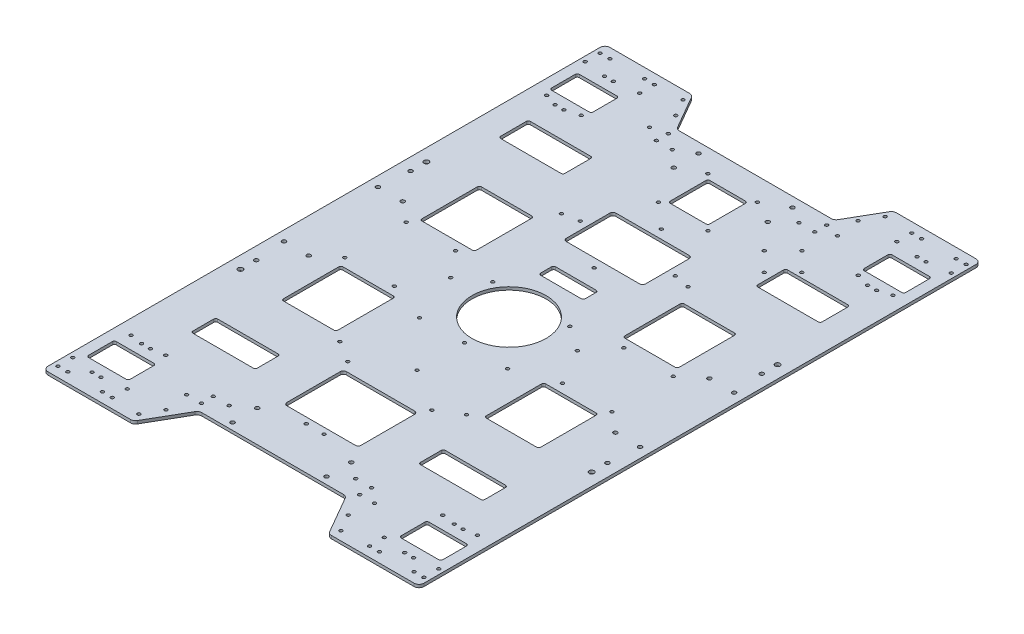
from build123d import *

# Parameters (mm, degrees)
EXTRUDE_1009_DEPTH      = 3
SKETCH_2_R              = 1.6
SKETCH_2_R_2            = 37.5
CUT_EXTRUDE_1674_DEPTH  = 3
SKETCH_8_W              = 65
SKETCH_8_H              = 25
CUT_EXTRUDE_2546_DEPTH  = 3
SKETCH_41_W             = 55
SKETCH_41_H             = 60
CUT_EXTRUDE_2_DEPTH     = 10
SKETCH_10_W             = 65
SKETCH_10_H             = 30
CUT_EXTRUDE_3752_DEPTH  = 3
SKETCH_11_R             = 1.6
SKETCH_11_W             = 42
SKETCH_11_H             = 28
CUT_EXTRUDE_4861_DEPTH  = 3
SKETCH_13_R             = 1.6
CUT_EXTRUDE_5517_DEPTH  = 3
SKETCH_14_R             = 2
CUT_EXTRUDE_5867_DEPTH  = 3
SKETCH_15_R             = 2
CUT_EXTRUDE_6127_DEPTH  = 3
SKETCH_16_R             = 1.6
CUT_EXTRUDE_6634_DEPTH  = 3
SKETCH_19_R             = 2
SKETCH_19_R_2           = 2.5
CUT_EXTRUDE_7800_DEPTH  = 3
SKETCH_21_R             = 1.6
CUT_EXTRUDE_7952_DEPTH  = 3
CUT_EXTRUDE_9_DEPTH     = 10
SKETCH_33_R             = 1.6
PC_DEPTH                = 10
SKETCH_36_R             = 1.6
CUT_EXTRUDE_9295_DEPTH  = 345.206333469
SKETCH_29_R             = 1.6
CUT_EXTRUDE_9677_DEPTH  = 10
SKETCH_39_R             = 1.6
CUT_EXTRUDE_10279_DEPTH = 10
SKETCH_42_W             = 40
SKETCH_42_H             = 40
CUT_EXTRUDE_11_DEPTH    = 10
SKETCH_34_R             = 1.6
UWB_DEPTH               = 10
SKETCH_47_R             = 1.6
CUT_EXTRUDE_13112_DEPTH = 345.206333469
SKETCH_48_R             = 1.6
CUT_EXTRUDE_14_DEPTH    = 345.206333469
CUT_EXTRUDE_6623_DEPTH  = 10
FILLET_13907_R          = 5
FILLET_14506_R          = 2
SKETCH_53_R             = 1.6
RFID_DEPTH              = 10
SKETCH_54_R             = 1.6
CUT_EXTRUDE_19127_DEPTH = 10


with BuildPart() as part:
    # 草图1 → Extrude 1009 (new body)
    with BuildSketch(Plane(origin=(0, 0, 0), x_dir=(1, 0, 0), z_dir=(0, 1, 0))):
        Polygon((190, 287), (101.545, 287), (79.605689771, 249), (-79.605689771, 249), (-101.545, 287), (-190, 287), (-190, 0), (-190, -281), (-144.091695942, -281), (-98.660254038, -281), (-74.411542732, -239), (74.411542732, -239), (98.660254038, -281), (144.091695942, -281), (190, -281), (190, 0), align=None)
    extrude(amount=EXTRUDE_1009_DEPTH)

    # 草图2 → Cut-Extrude 1674 (cut)
    with BuildSketch(Plane(origin=(0, 3, 0), x_dir=(1, 0, 0), z_dir=(0, 1, 0))):
        with Locations(Location((38.97114317, 22.5, 0), (0, 0, 270))):
            Circle(SKETCH_2_R)
        with Locations(Location((0, 0, 0), (0, 0, 270))):
            Circle(SKETCH_2_R_2)
        with Locations(Location((0, -45, 0), (0, 0, 270))):
            Circle(SKETCH_2_R)
        with Locations(Location((-38.97114317, 22.5, 0), (0, 0, 270))):
            Circle(SKETCH_2_R)
    extrude(amount=-CUT_EXTRUDE_1674_DEPTH, mode=Mode.SUBTRACT)

    # 草图8 → Cut-Extrude 2546 (cut)
    with BuildSketch(Plane(origin=(0, 3, 0), x_dir=(1, 0, 0), z_dir=(0, 1, 0))):
        with Locations((115, -161.5)):
            Rectangle(SKETCH_8_W, SKETCH_8_H)
        with Locations((-115, -161.5)):
            Rectangle(SKETCH_8_W, SKETCH_8_H)
    extrude(amount=-CUT_EXTRUDE_2546_DEPTH, mode=Mode.SUBTRACT)

    # 草图41 → 减重过线孔2 (cut)
    with BuildSketch(Plane(origin=(0, 3, 0), x_dir=(1, 0, 0), z_dir=(0, 1, 0))):
        with Locations((-102.5, 70)):
            Rectangle(SKETCH_41_W, SKETCH_41_H)
        with Locations((102.5, 70)):
            Rectangle(SKETCH_41_W, SKETCH_41_H)
        with Locations((102.5, -70)):
            Rectangle(SKETCH_41_W, SKETCH_41_H)
        with Locations((-102.5, -70)):
            Rectangle(SKETCH_41_W, SKETCH_41_H)
    extrude(amount=-CUT_EXTRUDE_2_DEPTH, mode=Mode.SUBTRACT)

    # 草图10 → Cut-Extrude 3752 (cut)
    with BuildSketch(Plane(origin=(0, 3, 0), x_dir=(1, 0, 0), z_dir=(0, 1, 0))):
        with Locations((-130, 167)):
            Rectangle(SKETCH_10_W, SKETCH_10_H)
        with Locations((130, 167)):
            Rectangle(SKETCH_10_W, SKETCH_10_H)
    extrude(amount=-CUT_EXTRUDE_3752_DEPTH, mode=Mode.SUBTRACT)

    # 草图11 → Cut-Extrude 4861 (cut)
    with BuildSketch(Plane(origin=(0, 3, 0), x_dir=(1, 0, 0), z_dir=(0, 1, 0))):
        with Locations(Location((-153.5, 259, 0), (0, 0, 270))):
            Circle(SKETCH_11_R)
        with Locations(Location((-162.5, 259, 0), (0, 0, 90))):
            Circle(SKETCH_11_R)
        with Locations(Location((-153.5, 209, 0), (0, 0, 90))):
            Circle(SKETCH_11_R)
        with Locations(Location((-162.5, 209, 0), (0, 0, 270))):
            Circle(SKETCH_11_R)
        with Locations(Location((153.5, 259, 0), (0, 0, 90))):
            Circle(SKETCH_11_R)
        with Locations(Location((162.5, 259, 0), (0, 0, 270))):
            Circle(SKETCH_11_R)
        with Locations(Location((153.5, 209, 0), (0, 0, 270))):
            Circle(SKETCH_11_R)
        with Locations(Location((162.5, 209, 0), (0, 0, 90))):
            Circle(SKETCH_11_R)
        with Locations(Location((162.5, -209, 0), (0, 0, 270))):
            Circle(SKETCH_11_R)
        with Locations(Location((153.5, -209, 0), (0, 0, 90))):
            Circle(SKETCH_11_R)
        with Locations(Location((162.5, -259, 0), (0, 0, 90))):
            Circle(SKETCH_11_R)
        with Locations(Location((153.5, -259, 0), (0, 0, 270))):
            Circle(SKETCH_11_R)
        with Locations(Location((-162.5, -209, 0), (0, 0, 90))):
            Circle(SKETCH_11_R)
        with Locations(Location((-153.5, -209, 0), (0, 0, 270))):
            Circle(SKETCH_11_R)
        with Locations(Location((-153.5, -259, 0), (0, 0, 90))):
            Circle(SKETCH_11_R)
        with Locations(Location((-162.5, -259, 0), (0, 0, 270))):
            Circle(SKETCH_11_R)
        with Locations((-158, 234)):
            Rectangle(SKETCH_11_W, SKETCH_11_H)
        with Locations((158, 234)):
            Rectangle(SKETCH_11_W, SKETCH_11_H)
        with Locations((158, -234)):
            Rectangle(SKETCH_11_W, SKETCH_11_H)
        with Locations((-158, -234)):
            Rectangle(SKETCH_11_W, SKETCH_11_H)
    extrude(amount=-CUT_EXTRUDE_4861_DEPTH, mode=Mode.SUBTRACT)

    # 草图13 → Cut-Extrude 5517 (cut)
    with BuildSketch(Plane(origin=(0, 3, 0), x_dir=(1, 0, 0), z_dir=(0, 1, 0))):
        with Locations(Location((25, 176, 0), (0, 0, 270))):
            Circle(SKETCH_13_R)
        with Locations(Location((25, 226, 0), (0, 0, 270))):
            Circle(SKETCH_13_R)
        with Locations(Location((-25, 226, 0), (0, 0, 270))):
            Circle(SKETCH_13_R)
        with Locations(Location((-25, 176, 0), (0, 0, 270))):
            Circle(SKETCH_13_R)
    extrude(amount=-CUT_EXTRUDE_5517_DEPTH, mode=Mode.SUBTRACT)

    # 草图14 → Cut-Extrude 5867 (cut)
    with BuildSketch(Plane(origin=(0, 3, 0), x_dir=(1, 0, 0), z_dir=(0, 1, 0))):
        with Locations(Location((-47.5, 239, 0), (0, 0, 270))):
            Circle(SKETCH_14_R)
        with Locations(Location((-47.5, 214, 0), (0, 0, 270))):
            Circle(SKETCH_14_R)
        with Locations(Location((47.5, 214, 0), (0, 0, 90))):
            Circle(SKETCH_14_R)
        with Locations(Location((47.5, 239, 0), (0, 0, 90))):
            Circle(SKETCH_14_R)
        with Locations(Location((-47.5, -207, 0), (0, 0, 270))):
            Circle(SKETCH_14_R)
        with Locations(Location((-47.5, -232, 0), (0, 0, 270))):
            Circle(SKETCH_14_R)
        with Locations(Location((47.5, -232, 0), (0, 0, 90))):
            Circle(SKETCH_14_R)
        with Locations(Location((47.5, -207, 0), (0, 0, 90))):
            Circle(SKETCH_14_R)
    extrude(amount=-CUT_EXTRUDE_5867_DEPTH, mode=Mode.SUBTRACT)

    # 草图15 → Cut-Extrude 6127 (cut)
    with BuildSketch(Plane(origin=(0, 3, 0), x_dir=(1, 0, 0), z_dir=(0, 1, 0))):
        with Locations(Location((155, 47.5, 0), (0, 0, 270))):
            Circle(SKETCH_15_R)
        with Locations(Location((180, 47.5, 0), (0, 0, 270))):
            Circle(SKETCH_15_R)
        with Locations(Location((180, -47.5, 0), (0, 0, 90))):
            Circle(SKETCH_15_R)
        with Locations(Location((155, -47.5, 0), (0, 0, 90))):
            Circle(SKETCH_15_R)
        with Locations(Location((-155, -47.5, 0), (0, 0, 270))):
            Circle(SKETCH_15_R)
        with Locations(Location((-180, -47.5, 0), (0, 0, 270))):
            Circle(SKETCH_15_R)
        with Locations(Location((-180, 47.5, 0), (0, 0, 90))):
            Circle(SKETCH_15_R)
        with Locations(Location((-155, 47.5, 0), (0, 0, 90))):
            Circle(SKETCH_15_R)
    extrude(amount=-CUT_EXTRUDE_6127_DEPTH, mode=Mode.SUBTRACT)

    # 草图16 → Cut-Extrude 6634 (cut)
    with BuildSketch(Plane(origin=(0, 3, 0), x_dir=(1, 0, 0), z_dir=(0, 1, 0))):
        with Locations(Location((-64, 229, 0), (0, 0, 270))):
            Circle(SKETCH_16_R)
        with Locations(Location((-64, 117, 0), (0, 0, 270))):
            Circle(SKETCH_16_R)
        with Locations(Location((-64, 5, 0), (0, 0, 270))):
            Circle(SKETCH_16_R)
        with Locations(Location((-64, -107, 0), (0, 0, 270))):
            Circle(SKETCH_16_R)
        with Locations(Location((-64, -219, 0), (0, 0, 270))):
            Circle(SKETCH_16_R)
        with Locations(Location((64, 229, 0), (0, 0, 90))):
            Circle(SKETCH_16_R)
        with Locations(Location((64, -107, 0), (0, 0, 90))):
            Circle(SKETCH_16_R)
        with Locations(Location((64, 5, 0), (0, 0, 90))):
            Circle(SKETCH_16_R)
        with Locations(Location((64, 117, 0), (0, 0, 90))):
            Circle(SKETCH_16_R)
        with Locations(Location((64, -219, 0), (0, 0, 90))):
            Circle(SKETCH_16_R)
    extrude(amount=-CUT_EXTRUDE_6634_DEPTH, mode=Mode.SUBTRACT)

    # 草图19 → Cut-Extrude 7800 (cut)
    with BuildSketch(Plane(origin=(0, 3, 0), x_dir=(1, 0, 0), z_dir=(0, 1, 0))):
        with Locations(Location((-177.5, -78, 0), (0, 0, 270))):
            Circle(SKETCH_19_R)
        with Locations(Location((-177.5, -94, 0), (0, 0, 270))):
            Circle(SKETCH_19_R_2)
        with Locations(Location((-177.5, 94, 0), (0, 0, 90))):
            Circle(SKETCH_19_R_2)
        with Locations(Location((-177.5, 78, 0), (0, 0, 90))):
            Circle(SKETCH_19_R)
        with Locations(Location((177.5, -94, 0), (0, 0, 90))):
            Circle(SKETCH_19_R_2)
        with Locations(Location((177.5, -78, 0), (0, 0, 90))):
            Circle(SKETCH_19_R)
        with Locations(Location((177.5, 78, 0), (0, 0, 270))):
            Circle(SKETCH_19_R)
        with Locations(Location((177.5, 94, 0), (0, 0, 270))):
            Circle(SKETCH_19_R_2)
    extrude(amount=-CUT_EXTRUDE_7800_DEPTH, mode=Mode.SUBTRACT)

    # 草图21 → Cut-Extrude 7952 (cut)
    with BuildSketch(Plane(origin=(0, 3, 0), x_dir=(1, 0, 0), z_dir=(0, 1, 0))):
        with Locations(Location((0, -93, 0), (0, 0, 270))):
            Circle(SKETCH_21_R)
    extrude(amount=-CUT_EXTRUDE_7952_DEPTH, mode=Mode.SUBTRACT)

    # 草图32 → 切除-拉伸9 (cut)
    with BuildSketch(Plane(origin=(0, 3, 0), x_dir=(1, 0, 0), z_dir=(0, 1, 0))):
        with BuildLine():
            Line((-34.5, -190), (34.5, -190))
            ThreePointArc((34.5, -190), (36.621320344, -189.121320344), (37.5, -187))
            Line((37.5, -187), (37.5, -133))
            ThreePointArc((37.5, -133), (36.621320344, -130.878679656), (34.5, -130))
            Line((34.5, -130), (-34.5, -130))
            ThreePointArc((-34.5, -130), (-36.621320344, -130.878679656), (-37.5, -133))
            Line((-37.5, -133), (-37.5, -187))
            ThreePointArc((-37.5, -187), (-36.621320344, -189.121320344), (-34.5, -190))
        make_face()
    extrude(amount=-CUT_EXTRUDE_9_DEPTH, mode=Mode.SUBTRACT)

    # 草图33 → PC座固定孔 (cut)
    with BuildSketch(Plane(origin=(0, 3, 0), x_dir=(1, 0, 0), z_dir=(0, 1, 0))):
        with Locations(Location((-42.5, -120.5, 0), (0, 0, 270))):
            Circle(SKETCH_33_R)
        with Locations(Location((42.5, -120.5, 0), (0, 0, 90))):
            Circle(SKETCH_33_R)
    extrude(amount=-PC_DEPTH, mode=Mode.SUBTRACT)

    # 草图36 → Cut-Extrude 9295 (cut, through all)
    with BuildSketch(Plane(origin=(0, 3, 0), x_dir=(1, 0, 0), z_dir=(0, 1, 0))):
        with Locations(Location((-80, -231, 0), (0, 0, 270))):
            Circle(SKETCH_36_R)
        with Locations(Location((-80, -219, 0), (0, 0, 270))):
            Circle(SKETCH_36_R)
        with Locations(Location((80, -219, 0), (0, 0, 90))):
            Circle(SKETCH_36_R)
        with Locations(Location((80, -231, 0), (0, 0, 90))):
            Circle(SKETCH_36_R)
        with Locations(Location((-80, 241, 0), (0, 0, 270))):
            Circle(SKETCH_36_R)
        with Locations(Location((-80, 229, 0), (0, 0, 270))):
            Circle(SKETCH_36_R)
        with Locations(Location((80, 229, 0), (0, 0, 90))):
            Circle(SKETCH_36_R)
        with Locations(Location((80, 241, 0), (0, 0, 90))):
            Circle(SKETCH_36_R)
    extrude(amount=-CUT_EXTRUDE_9295_DEPTH, mode=Mode.SUBTRACT)

    # 草图29 → Cut-Extrude 9677 (cut)
    with BuildSketch(Plane(origin=(0, 3, 0), x_dir=(1, 0, 0), z_dir=(0, 1, 0))):
        with Locations(Location((48, 120, 0), (0, 0, 270))):
            Circle(SKETCH_29_R)
        with Locations(Location((0, 86, 0), (0, 0, 270))):
            Circle(SKETCH_29_R)
        with Locations(Location((0, 154, 0), (0, 0, 90))):
            Circle(SKETCH_29_R)
        with Locations(Location((-48, 120, 0), (0, 0, 90))):
            Circle(SKETCH_29_R)
        with BuildLine():
            Line((40, 98), (40, 142))
            ThreePointArc((40, 142), (39.121320344, 144.121320344), (37, 145))
            Line((37, 145), (-37, 145))
            ThreePointArc((-37, 145), (-39.121320344, 144.121320344), (-40, 142))
            Line((-40, 142), (-40, 98))
            ThreePointArc((-40, 98), (-39.121320344, 95.878679656), (-37, 95))
            Line((-37, 95), (37, 95))
            ThreePointArc((37, 95), (39.121320344, 95.878679656), (40, 98))
        make_face()
    extrude(amount=-CUT_EXTRUDE_9677_DEPTH, mode=Mode.SUBTRACT)

    # 草图39 → Cut-Extrude 10279 (cut)
    with BuildSketch(Plane(origin=(0, 3, 0), x_dir=(1, 0, 0), z_dir=(0, 1, 0))):
        with Locations(Location((185, -271, 0), (0, 0, 270))):
            Circle(SKETCH_39_R)
        with Locations(Location((185, -256, 0), (0, 0, 270))):
            Circle(SKETCH_39_R)
        with Locations(Location((130, -256, 0), (0, 0, 90))):
            Circle(SKETCH_39_R)
        with Locations(Location((130, -271, 0), (0, 0, 90))):
            Circle(SKETCH_39_R)
        with Locations(Location((-130, -271, 0), (0, 0, 270))):
            Circle(SKETCH_39_R)
        with Locations(Location((-130, -256, 0), (0, 0, 270))):
            Circle(SKETCH_39_R)
        with Locations(Location((-185, -256, 0), (0, 0, 90))):
            Circle(SKETCH_39_R)
        with Locations(Location((-185, -271, 0), (0, 0, 90))):
            Circle(SKETCH_39_R)
        with Locations(Location((-130, 262, 0), (0, 0, 90))):
            Circle(SKETCH_39_R)
        with Locations(Location((-130, 277, 0), (0, 0, 90))):
            Circle(SKETCH_39_R)
        with Locations(Location((185, 262, 0), (0, 0, 90))):
            Circle(SKETCH_39_R)
        with Locations(Location((185, 277, 0), (0, 0, 90))):
            Circle(SKETCH_39_R)
        with Locations(Location((-185, 277, 0), (0, 0, 270))):
            Circle(SKETCH_39_R)
        with Locations(Location((-185, 262, 0), (0, 0, 270))):
            Circle(SKETCH_39_R)
        with Locations(Location((130, 277, 0), (0, 0, 270))):
            Circle(SKETCH_39_R)
        with Locations(Location((130, 262, 0), (0, 0, 270))):
            Circle(SKETCH_39_R)
    extrude(amount=-CUT_EXTRUDE_10279_DEPTH, mode=Mode.SUBTRACT)

    # 草图42 → 切除-拉伸11 (cut)
    with BuildSketch(Plane(origin=(0, 3, 0), x_dir=(1, 0, 0), z_dir=(0, 1, 0))):
        with Locations((0, 201)):
            Rectangle(SKETCH_42_W, SKETCH_42_H)
    extrude(amount=-CUT_EXTRUDE_11_DEPTH, mode=Mode.SUBTRACT)

    # 草图34 → UWB固定孔 (cut)
    with BuildSketch(Plane(origin=(0, 3, 0), x_dir=(1, 0, 0), z_dir=(0, 1, 0))):
        with Locations(Location((90, 168, 0), (0, 0, 270))):
            Circle(SKETCH_34_R)
        with Locations(Location((71, 187, 0), (0, 0, 270))):
            Circle(SKETCH_34_R)
        with Locations(Location((90, 206, 0), (0, 0, 270))):
            Circle(SKETCH_34_R)
        with Locations(Location((109, 187, 0), (0, 0, 270))):
            Circle(SKETCH_34_R)
    extrude(amount=-UWB_DEPTH, mode=Mode.SUBTRACT)

    # 草图47 → Cut-Extrude 13112 (cut, through all)
    with BuildSketch(Plane(origin=(0, 3, 0), x_dir=(1, 0, 0), z_dir=(0, 1, 0))):
        with Locations(Location((140, 277, 0), (0, 0, 270))):
            Circle(SKETCH_47_R)
        with Locations(Location((185, -271, 0), (0, 0, 270))):
            Circle(SKETCH_47_R)
        with Locations(Location((95, -231, 0), (0, 0, 270))):
            Circle(SKETCH_47_R)
        with Locations(Location((175, -271, 0), (0, 0, 270))):
            Circle(SKETCH_47_R)
        with Locations(Location((140, 213, 0), (0, 0, 270))):
            Circle(SKETCH_47_R)
        with Locations(Location((175, -207, 0), (0, 0, 270))):
            Circle(SKETCH_47_R)
        with Locations(Location((-140, -271, 0), (0, 0, 90))):
            Circle(SKETCH_47_R)
        with Locations(Location((-140, -207, 0), (0, 0, 90))):
            Circle(SKETCH_47_R)
        with Locations(Location((-175, 213, 0), (0, 0, 90))):
            Circle(SKETCH_47_R)
        with Locations(Location((-95, 237, 0), (0, 0, 90))):
            Circle(SKETCH_47_R)
        with Locations(Location((185, 277, 0), (0, 0, 90))):
            Circle(SKETCH_47_R)
        with Locations(Location((175, 277, 0), (0, 0, 270))):
            Circle(SKETCH_47_R)
        with Locations(Location((95, 237, 0), (0, 0, 270))):
            Circle(SKETCH_47_R)
        with Locations(Location((175, 213, 0), (0, 0, 270))):
            Circle(SKETCH_47_R)
        with Locations(Location((-175, 277, 0), (0, 0, 90))):
            Circle(SKETCH_47_R)
        with Locations(Location((-185, 277, 0), (0, 0, 270))):
            Circle(SKETCH_47_R)
        with Locations(Location((140, -207, 0), (0, 0, 270))):
            Circle(SKETCH_47_R)
        with Locations(Location((140, -271, 0), (0, 0, 270))):
            Circle(SKETCH_47_R)
        with Locations(Location((-175, -207, 0), (0, 0, 90))):
            Circle(SKETCH_47_R)
        with Locations(Location((-140, 213, 0), (0, 0, 90))):
            Circle(SKETCH_47_R)
        with Locations(Location((-175, -271, 0), (0, 0, 90))):
            Circle(SKETCH_47_R)
        with Locations(Location((-95, -231, 0), (0, 0, 90))):
            Circle(SKETCH_47_R)
        with Locations(Location((-185, -271, 0), (0, 0, 90))):
            Circle(SKETCH_47_R)
        with Locations(Location((-140, 277, 0), (0, 0, 90))):
            Circle(SKETCH_47_R)
    extrude(amount=-CUT_EXTRUDE_13112_DEPTH, mode=Mode.SUBTRACT)

    # 草图48 → 切除-拉伸14 (cut, through all)
    with BuildSketch(Plane(origin=(0, 3, 0), x_dir=(1, 0, 0), z_dir=(0, 1, 0))):
        with Locations(Location((-44.5, -46, 0), (0, 0, 270))):
            Circle(SKETCH_48_R)
        with Locations(Location((44.5, -46, 0), (0, 0, 90))):
            Circle(SKETCH_48_R)
        with Locations(Location((-9, -196, 0), (0, 0, 270))):
            Circle(SKETCH_48_R)
        with Locations(Location((9, -196, 0), (0, 0, 90))):
            Circle(SKETCH_48_R)
    extrude(amount=-CUT_EXTRUDE_14_DEPTH, mode=Mode.SUBTRACT)

    # 草图51 → 6623电机过线孔 (cut)
    with BuildSketch(Plane(origin=(0, 3, 0), x_dir=(1, 0, 0), z_dir=(0, 1, 0))):
        with BuildLine():
            Line((-20.5, 67.5), (20.5, 67.5))
            ThreePointArc((20.5, 67.5), (21.914213562, 66.914213562), (22.5, 65.5))
            Line((22.5, 65.5), (22.5, 54.5))
            ThreePointArc((22.5, 54.5), (21.914213562, 53.085786438), (20.5, 52.5))
            Line((20.5, 52.5), (-20.5, 52.5))
            ThreePointArc((-20.5, 52.5), (-21.914213562, 53.085786438), (-22.5, 54.5))
            Line((-22.5, 54.5), (-22.5, 65.5))
            ThreePointArc((-22.5, 65.5), (-21.914213562, 66.914213562), (-20.5, 67.5))
        make_face()
    extrude(amount=-CUT_EXTRUDE_6623_DEPTH, mode=Mode.SUBTRACT)

    # Fillet 13907
    fillet_13907_edges = [part.edges().sort_by_distance(p)[0] for p in [
        (-190, 1.5, -287),
        (-101.545, 1.5, -287),
        (-79.605689771, 1.5, -249),
        (79.605689771, 1.5, -249),
        (101.545, 1.5, -287),
        (190, 1.5, -287),
        (190, 1.5, 281),
        (98.660254038, 1.5, 281),
        (74.411542732, 1.5, 239),
        (-74.411542732, 1.5, 239),
        (-98.660254038, 1.5, 281),
        (-190, 1.5, 281),
    ]]
    fillet(fillet_13907_edges, radius=FILLET_13907_R)

    # Fillet 14506
    fillet_14506_edges = [part.edges().sort_by_distance(p)[0] for p in [
        (-130, 1.5, -40),
        (-130, 1.5, -100),
        (-75, 1.5, -100),
        (-75, 1.5, -40),
        (75, 1.5, -100),
        (130, 1.5, -100),
        (130, 1.5, -40),
        (75, 1.5, -40),
        (130, 1.5, 40),
        (130, 1.5, 100),
        (75, 1.5, 100),
        (75, 1.5, 40),
        (-75, 1.5, 100),
        (-130, 1.5, 100),
        (-130, 1.5, 40),
        (-75, 1.5, 40),
        (-97.5, 1.5, -182),
        (-97.5, 1.5, -152),
        (-162.5, 1.5, -152),
        (-162.5, 1.5, -182),
        (162.5, 1.5, -182),
        (162.5, 1.5, -152),
        (97.5, 1.5, -152),
        (97.5, 1.5, -182),
        (-137, 1.5, -248),
        (-137, 1.5, -220),
        (-179, 1.5, -220),
        (-179, 1.5, -248),
        (137, 1.5, -248),
        (179, 1.5, -248),
        (179, 1.5, -220),
        (137, 1.5, -220),
        (179, 1.5, 220),
        (179, 1.5, 248),
        (137, 1.5, 248),
        (137, 1.5, 220),
        (-137, 1.5, 248),
        (-179, 1.5, 248),
        (-179, 1.5, 220),
        (-137, 1.5, 220),
        (-147.5, 1.5, 174),
        (20, 1.5, -221),
        (20, 1.5, -181),
        (-20, 1.5, -181),
        (-20, 1.5, -221),
        (-147.5, 1.5, 149),
        (-82.5, 1.5, 149),
        (-82.5, 1.5, 174),
        (82.5, 1.5, 174),
        (82.5, 1.5, 149),
        (147.5, 1.5, 149),
        (147.5, 1.5, 174),
    ]]
    fillet(fillet_14506_edges, radius=FILLET_14506_R)

    # 草图53 → RFID固定孔 (cut)
    with BuildSketch(Plane(origin=(0, 3, 0), x_dir=(1, 0, 0), z_dir=(0, 1, 0))):
        with Locations(Location((-135, -31, 0), (0, 0, 270))):
            Circle(SKETCH_53_R)
        with Locations(Location((-85, -31, 0), (0, 0, 270))):
            Circle(SKETCH_53_R)
        with Locations(Location((-85, 31, 0), (0, 0, 270))):
            Circle(SKETCH_53_R)
        with Locations(Location((-135, 31, 0), (0, 0, 270))):
            Circle(SKETCH_53_R)
        with Locations(Location((135, 31, 0), (0, 0, 90))):
            Circle(SKETCH_53_R)
        with Locations(Location((85, 31, 0), (0, 0, 90))):
            Circle(SKETCH_53_R)
        with Locations(Location((85, -31, 0), (0, 0, 90))):
            Circle(SKETCH_53_R)
        with Locations(Location((135, -31, 0), (0, 0, 90))):
            Circle(SKETCH_53_R)
    extrude(amount=-RFID_DEPTH, mode=Mode.SUBTRACT)

    # 草图54 → Cut-Extrude 19127 (cut)
    with BuildSketch(Plane.XZ):
        with Locations(Location((-102.122350269, -278, 0), (0, 0, 270))):
            Circle(SKETCH_54_R)
        with Locations(Location((-92.122350269, -260.679491924, 0), (0, 0, 270))):
            Circle(SKETCH_54_R)
        with Locations(Location((92.122350269, -260.679491924, 0), (0, 0, 270))):
            Circle(SKETCH_54_R)
        with Locations(Location((102.122350269, -278, 0), (0, 0, 270))):
            Circle(SKETCH_54_R)
        with Locations(Location((102.122350269, 272, 0), (0, 0, 270))):
            Circle(SKETCH_54_R)
        with Locations(Location((92.122350269, 254.679491924, 0), (0, 0, 270))):
            Circle(SKETCH_54_R)
        with Locations(Location((-92.122350269, 254.679491924, 0), (0, 0, 270))):
            Circle(SKETCH_54_R)
        with Locations(Location((-102.122350269, 272, 0), (0, 0, 270))):
            Circle(SKETCH_54_R)
    extrude(amount=-CUT_EXTRUDE_19127_DEPTH, mode=Mode.SUBTRACT)


solid = part.part
